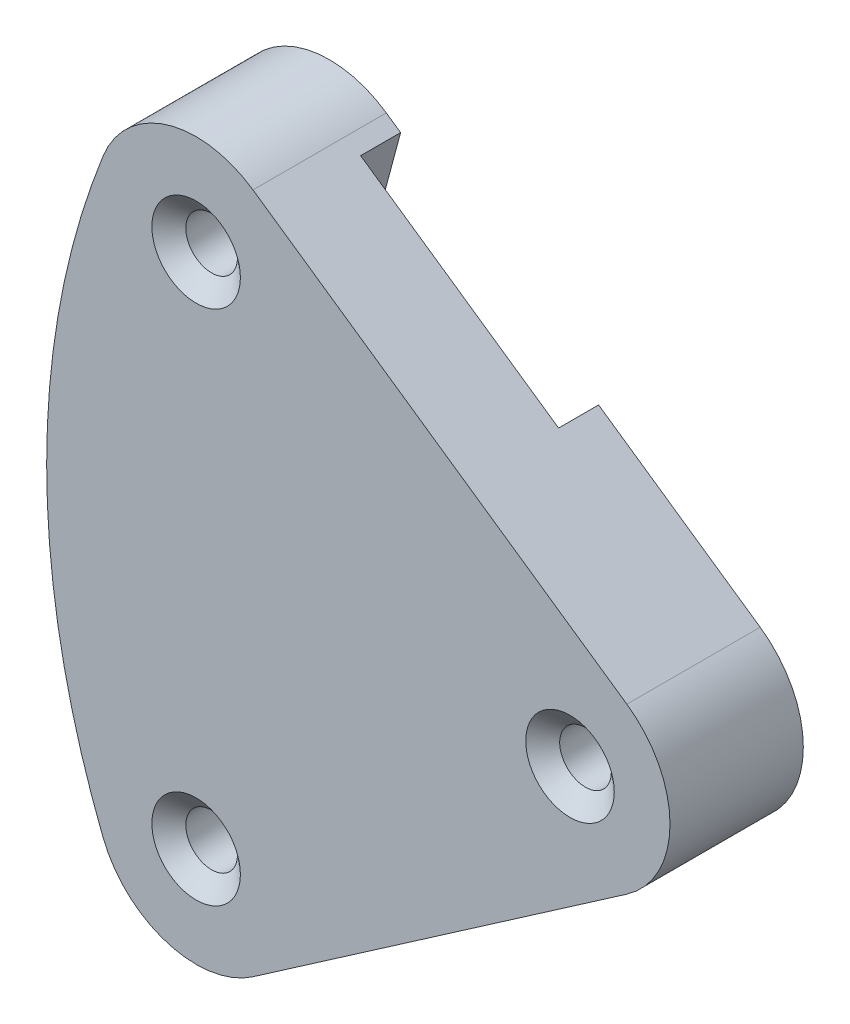
from build123d import *

# Parameters (mm, degrees)
BOSS_EXTRUDE1_DEPTH                               = 12.7
SKETCH2_R                                         = 101.6
SKETCH2_R_2                                       = 76.2
CUT_EXTRUDE1_DEPTH                                = 59.220358606
FILLET1_R                                         = 9.525
CSK_FOR_8_FLAT_HEAD_MACHINE_SCREW_100_D           = 4.9149
CSK_FOR_8_FLAT_HEAD_MACHINE_SCREW_100_CSINK_D     = 8.4328
CSK_FOR_8_FLAT_HEAD_MACHINE_SCREW_100_CSINK_ANGLE = 100
CUT_EXTRUDE2_START                                = -6.35
CUT_EXTRUDE2_DEPTH                                = 6.35
CUT_EXTRUDE3_DEPTH                                = 3.81
SKETCH7_R                                         = 1.397
CUT_EXTRUDE4_DEPTH                                = 3.175
HOLE1_AT_2_COUNT                                  = 2
HOLE1_AT_2_PITCH                                  = 9.3599
HOLE1_AT_3_COUNT                                  = 2
HOLE1_AT_3_PITCH                                  = 38.818175673
HOLE1_AT_4_COUNT                                  = 2
HOLE1_AT_4_PITCH                                  = 40.17317123
F_2_CLEARANCE_HOLE1_D                             = 2.7051
F_2_CLEARANCE_HOLE1_DEPTH                         = 4.7625


with BuildPart() as part:
    # Sketch1 → Boss-Extrude1 (new body)
    with BuildSketch(Plane.XY):
        Polygon((33.299680929, 0), (-33.299680929, 46.0375), (-33.299680929, -46.0375), align=None)
    extrude(amount=BOSS_EXTRUDE1_DEPTH)

    # Sketch2 → Cut-Extrude1 (cut, through all)
    with BuildSketch(Plane.XY.offset(12.7)):
        with Locations((42.900319071, 0)):
            Circle(SKETCH2_R)
        with Locations((42.900319071, 0)):
            Circle(SKETCH2_R_2, mode=Mode.SUBTRACT)
    extrude(amount=-CUT_EXTRUDE1_DEPTH, mode=Mode.SUBTRACT)

    # Fillet1
    fillet1_edges = [part.edges().sort_by_distance(p)[0] for p in [
        (-22.72460624, -38.727369881, 6.35),
        (-22.72460624, 38.727369881, 6.35),
        (33.299680929, 0, 6.35),
    ]]
    fillet(fillet1_edges, radius=FILLET1_R)

    # CSK for #8 Flat Head Machine Screw (100)1 (through all)
    with Locations(Plane.XY.offset(12.7)):
        with Locations((-19.063658953, -24.617494846), (-19.063658953, 24.617494846), (16.54881886, 0)):
            CounterSinkHole(CSK_FOR_8_FLAT_HEAD_MACHINE_SCREW_100_D / 2, CSK_FOR_8_FLAT_HEAD_MACHINE_SCREW_100_CSINK_D / 2, counter_sink_angle=CSK_FOR_8_FLAT_HEAD_MACHINE_SCREW_100_CSINK_ANGLE)

    # Sketch5 → Cut-Extrude2 (cut)
    with BuildSketch(Plane(origin=(0, 0, 0), x_dir=(-1, 0, 0), z_dir=(0, 0, -1)).offset(CUT_EXTRUDE2_START)):
        with BuildLine():
            Line((30.823542048, 19.267389595), (-18.192319797, 6.133628997))
            ThreePointArc((-18.192319797, 6.133628997), (-22.89881886, 0), (-18.192319797, -6.133628997))
            Line((-18.192319797, -6.133628997), (30.823542048, -19.267389595))
            ThreePointArc((30.823542048, -19.267389595), (33.299680929, 0), (30.823542048, 19.267389595))
        make_face()
    extrude(amount=CUT_EXTRUDE2_DEPTH, mode=Mode.SUBTRACT)

    # Sketch6 → Cut-Extrude3 (cut)
    with BuildSketch(Plane(origin=(0, 0, 0), x_dir=(-1, 0, 0), z_dir=(0, 0, -1))):
        Polygon((16.588726313, -15.453182214), (-4.265612277, -9.86527903), (-8.867414899, -27.039440222), (11.986923691, -32.627343405), align=None)
        Polygon((11.986923691, 32.627343405), (-8.867414899, 27.039440222), (-4.265612277, 9.86527903), (16.588726313, 15.453182214), align=None)
    extrude(amount=-CUT_EXTRUDE3_DEPTH, mode=Mode.SUBTRACT)

    # Sketch7 → Cut-Extrude4 (cut)
    with BuildSketch(Plane(origin=(0, 0, 6.35), x_dir=(-1, 0, 0), z_dir=(0, 0, -1))):
        with Locations((21.479680921, -10.189705806)):
            Circle(SKETCH7_R)
        with Locations(Location((21.479680921, 10.189705806, 0), (0, 0, 180))):
            Circle(SKETCH7_R)
    extrude(amount=-CUT_EXTRUDE4_DEPTH, mode=Mode.SUBTRACT)

    # Sketch9 → Hole1 (revolve, cut)
    with BuildSketch(Plane(origin=(-8.904685942, -20.086585615, 3.81), x_dir=(0, 1, 0), z_dir=(1, 0, 0))):
        Polygon((0, 0), (0, 2.921), (1.4986, 2.921), (1.6383, 0), align=None)
    hole1 = revolve(axis=Axis((-8.904685942, -20.086585615, 113.81), (0, 0, -1)), mode=Mode.SUBTRACT)

    # Hole1 at 2: Hole1 ×2
    with Locations(*[Vector(0.9659258262890683, 0.25881904510252096, 0) * (i * HOLE1_AT_2_PITCH) for i in range(1, HOLE1_AT_2_COUNT)]):
        add(hole1, mode=Mode.SUBTRACT)

    # Hole1 at 3: Hole1 ×2
    with Locations(*[Vector(0.23290556510295454, 0.9724993561664057, 0) * (i * HOLE1_AT_3_PITCH) for i in range(1, HOLE1_AT_3_COUNT)]):
        add(hole1, mode=Mode.SUBTRACT)

    # Hole1 at 4: Hole1 ×2
    with Locations(*[(0, i * HOLE1_AT_4_PITCH, 0) for i in range(1, HOLE1_AT_4_COUNT)]):
        add(hole1, mode=Mode.SUBTRACT)

    # #2 Clearance Hole1
    with Locations(Plane(origin=(0, 0, 3.81), x_dir=(-1, 0, 0), z_dir=(0, 0, -1))):
        with Locations((8.904685942, -20.086585615), (-0.136283199, -17.664065235), (-0.136283199, 17.664065235), (8.904685942, 20.086585615)):
            Hole(F_2_CLEARANCE_HOLE1_D / 2, depth=F_2_CLEARANCE_HOLE1_DEPTH)


solid = part.part
